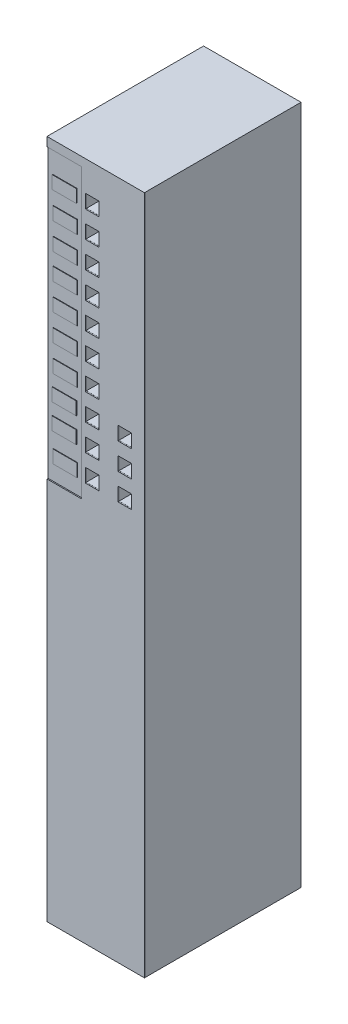
from build123d import *

# Parameters (mm, degrees)
CROQUIS1_W              = 178.587886288
CROQUIS1_H              = 1246.200179681
CROQUIS1_W_2            = 25
CROQUIS1_H_2            = 25
SALIENTE_EXTRUIR2_DEPTH = 285
CROQUIS2_W              = 178.587886288
CROQUIS2_H              = 550.793515283
SALIENTE_EXTRUIR3_DEPTH = 1
CROQUIS5_W              = 25
CROQUIS5_H              = 25
SALIENTE_EXTRUIR4_DEPTH = 2
CROQUIS10_W             = 44.39506519
CROQUIS10_H             = 23.654322963
CROQUIS10_H_2           = 23.654322964
SALIENTE_EXTRUIR5_DEPTH = 1


with BuildPart() as part:
    # Croquis1 → Saliente-Extruir2 (new body)
    with BuildSketch(Plane.XY):
        with Locations((121.784181129, -381.401832721)):
            Rectangle(CROQUIS1_W, CROQUIS1_H)
        with Locations((115.437079382, 174.360479256)):
            Rectangle(CROQUIS1_W_2, CROQUIS1_H_2, mode=Mode.SUBTRACT)
        with Locations((174.990237985, -163.957841157)):
            Rectangle(CROQUIS1_W_2, CROQUIS1_H_2, mode=Mode.SUBTRACT)
        with Locations((115.437079382, 126.027179256)):
            Rectangle(CROQUIS1_W_2, CROQUIS1_H_2, mode=Mode.SUBTRACT)
        with Locations((115.437079382, 77.694179256)):
            Rectangle(CROQUIS1_W_2, CROQUIS1_H_2, mode=Mode.SUBTRACT)
        with Locations((115.437079382, 29.364179256)):
            Rectangle(CROQUIS1_W_2, CROQUIS1_H_2, mode=Mode.SUBTRACT)
        with Locations((115.437079382, -18.965820744)):
            Rectangle(CROQUIS1_W_2, CROQUIS1_H_2, mode=Mode.SUBTRACT)
        with Locations((114.990237985, -67.291541157)):
            Rectangle(CROQUIS1_W_2, CROQUIS1_H_2, mode=Mode.SUBTRACT)
        with Locations((114.990237985, -115.624841157)):
            Rectangle(CROQUIS1_W_2, CROQUIS1_H_2, mode=Mode.SUBTRACT)
        with Locations((114.990237985, -163.957841157)):
            Rectangle(CROQUIS1_W_2, CROQUIS1_H_2, mode=Mode.SUBTRACT)
        with Locations((114.990237985, -212.287841157)):
            Rectangle(CROQUIS1_W_2, CROQUIS1_H_2, mode=Mode.SUBTRACT)
        with Locations((114.990237985, -260.617841157)):
            Rectangle(CROQUIS1_W_2, CROQUIS1_H_2, mode=Mode.SUBTRACT)
        with Locations((174.990237985, -212.287841157)):
            Rectangle(CROQUIS1_W_2, CROQUIS1_H_2, mode=Mode.SUBTRACT)
        with Locations((174.990237985, -260.617841157)):
            Rectangle(CROQUIS1_W_2, CROQUIS1_H_2, mode=Mode.SUBTRACT)
    extrude(amount=-SALIENTE_EXTRUIR2_DEPTH)

    # Croquis2 → Saliente-Extruir3 (add)
    with BuildSketch(Plane(origin=(0, 0, -285), x_dir=(-1, 0, 0), z_dir=(0, 0, -1))):
        with Locations((-121.784181129, -33.698500522)):
            Rectangle(CROQUIS2_W, CROQUIS2_H)
    extrude(amount=-SALIENTE_EXTRUIR3_DEPTH)

    # Croquis5 → Saliente-Extruir4 (add)
    with BuildSketch(Plane.XY):
        Polygon((40.133927115, 241.69825712), (187.776914698, 241.69825712), (211.365707843, 241.69825712), (211.365707843, -1004.501922561), (32.980151612, -1004.501922561), (32.980151612, -301.90284108), (95.791395616, -301.90284108), (95.791395616, 225.342265798), (32.490237985, 225.342265798), (32.490237985, 241.69825712), align=None)
        with Locations((115.723756094, 174.251217897)):
            Rectangle(CROQUIS5_W, CROQUIS5_H, mode=Mode.SUBTRACT)
        with Locations((175.276914698, -164.067102515)):
            Rectangle(CROQUIS5_W, CROQUIS5_H, mode=Mode.SUBTRACT)
        with Locations((115.723756094, 125.917917897)):
            Rectangle(CROQUIS5_W, CROQUIS5_H, mode=Mode.SUBTRACT)
        with Locations((115.723756094, 77.584917897)):
            Rectangle(CROQUIS5_W, CROQUIS5_H, mode=Mode.SUBTRACT)
        with Locations((115.723756094, 29.254917897)):
            Rectangle(CROQUIS5_W, CROQUIS5_H, mode=Mode.SUBTRACT)
        with Locations((115.723756094, -19.075082103)):
            Rectangle(CROQUIS5_W, CROQUIS5_H, mode=Mode.SUBTRACT)
        with Locations((115.276914698, -67.400802515)):
            Rectangle(CROQUIS5_W, CROQUIS5_H, mode=Mode.SUBTRACT)
        with Locations((115.276914698, -115.734102515)):
            Rectangle(CROQUIS5_W, CROQUIS5_H, mode=Mode.SUBTRACT)
        with Locations((115.276914698, -164.067102515)):
            Rectangle(CROQUIS5_W, CROQUIS5_H, mode=Mode.SUBTRACT)
        with Locations((115.276914698, -212.397102515)):
            Rectangle(CROQUIS5_W, CROQUIS5_H, mode=Mode.SUBTRACT)
        with Locations((115.276914698, -260.727102515)):
            Rectangle(CROQUIS5_W, CROQUIS5_H, mode=Mode.SUBTRACT)
        with Locations((175.276914698, -212.397102515)):
            Rectangle(CROQUIS5_W, CROQUIS5_H, mode=Mode.SUBTRACT)
        with Locations((175.276914698, -260.727102515)):
            Rectangle(CROQUIS5_W, CROQUIS5_H, mode=Mode.SUBTRACT)
    extrude(amount=SALIENTE_EXTRUIR4_DEPTH)

    # Croquis10 → Saliente-Extruir5 (add)
    with BuildSketch(Plane.XY):
        with Locations((62.970480914, 172.960872416)):
            Rectangle(CROQUIS10_W, CROQUIS10_H)
        with Locations((64.427271282, 75.386790193)):
            Rectangle(CROQUIS10_W, CROQUIS10_H_2)
        with Locations((64.427271282, -20.708896845)):
            Rectangle(CROQUIS10_W, CROQUIS10_H)
        with Locations((64.427271282, -69.495937956)):
            Rectangle(CROQUIS10_W, CROQUIS10_H)
        with Locations((64.427271282, -118.282979068)):
            Rectangle(CROQUIS10_W, CROQUIS10_H)
        with Locations((62.948876097, -164.113229809)):
            Rectangle(CROQUIS10_W, CROQUIS10_H)
        with Locations((62.948876097, -209.94348055)):
            Rectangle(CROQUIS10_W, CROQUIS10_H)
        with Locations((64.427271282, 28.078144267)):
            Rectangle(CROQUIS10_W, CROQUIS10_H)
        with Locations((64.427271282, 124.173831305)):
            Rectangle(CROQUIS10_W, CROQUIS10_H)
        with Locations((64.427271282, -261.687312031)):
            Rectangle(CROQUIS10_W, CROQUIS10_H_2)
    extrude(amount=SALIENTE_EXTRUIR5_DEPTH)


solid = part.part
